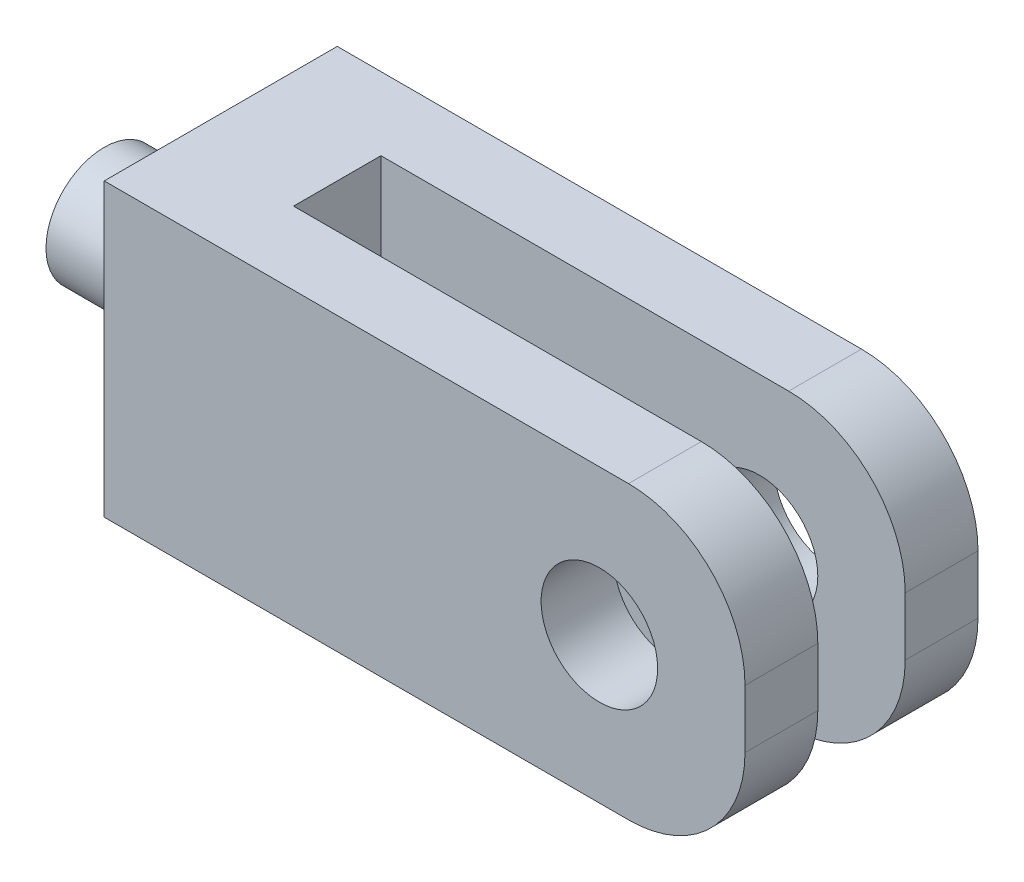
from build123d import *

# Parameters (mm, degrees)
SKETCH1_W           = 165
SKETCH1_H           = 75
BOSS_EXTRUDE1_DEPTH = 60
SKETCH2_W           = 22.5
SKETCH2_H           = 75
CUT_EXTRUDE1_DEPTH  = 135
FILLET1_R           = 30
SKETCH3_R           = 15
CUT_EXTRUDE2_DEPTH  = 109.685325596
SKETCH4_R           = 15
BOSS_EXTRUDE2_DEPTH = 30


with BuildPart() as part:
    # Sketch1 → Boss-Extrude1 (new body)
    with BuildSketch(Plane.XY):
        Rectangle(SKETCH1_W, SKETCH1_H)
    extrude(amount=BOSS_EXTRUDE1_DEPTH)

    # Sketch2 → Cut-Extrude1 (cut)
    with BuildSketch(Plane(origin=(82.5, 0, 0), x_dir=(0, 0, -1), z_dir=(1, 0, 0))):
        with Locations((-30, 0)):
            Rectangle(SKETCH2_W, SKETCH2_H)
    extrude(amount=-CUT_EXTRUDE1_DEPTH, mode=Mode.SUBTRACT)

    # Fillet1
    fillet1_edges = [part.edges().sort_by_distance(p)[0] for p in [
        (82.5, -37.5, 9.375),
        (82.5, 37.5, 9.375),
        (82.5, 37.5, 50.625),
        (82.5, -37.5, 50.625),
    ]]
    fillet(fillet1_edges, radius=FILLET1_R)

    # Sketch3 → Cut-Extrude2 (cut, through all)
    with BuildSketch(Plane.XY.offset(60)):
        with Locations((45, 0)):
            Circle(SKETCH3_R)
    extrude(amount=-CUT_EXTRUDE2_DEPTH, mode=Mode.SUBTRACT)

    # Sketch4 → Boss-Extrude2 (add)
    with BuildSketch(Plane.ZY.offset(82.5)):
        with Locations(Location((30, 0, 0), (0, 0, 180))):
            Circle(SKETCH4_R)
    extrude(amount=BOSS_EXTRUDE2_DEPTH)


solid = part.part
